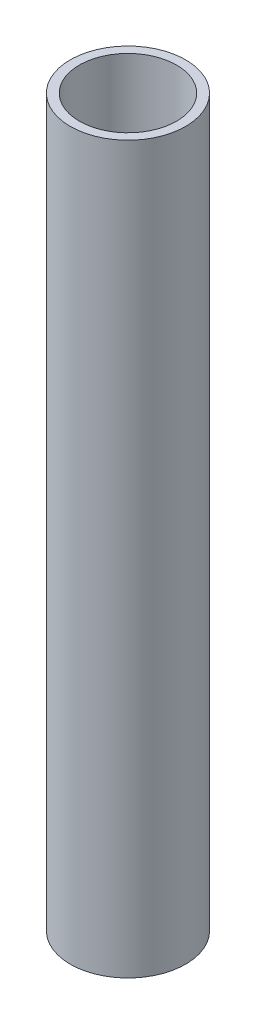
from build123d import *

# Parameters (mm, degrees)
SKETCH1_R           = 15.905
SKETCH1_R_2         = 13.405
BOSS_EXTRUDE1_DEPTH = 200


with BuildPart() as part:
    # Sketch1 → Boss-Extrude1 (new body)
    with BuildSketch(Plane(origin=(0, 0, 0), x_dir=(1, 0, 0), z_dir=(0, 1, 0))):
        with Locations(Location((0, 0, 0), (0, 0, 270))):
            Circle(SKETCH1_R)
        with Locations(Location((0, 0, 0), (0, 0, 270))):
            Circle(SKETCH1_R_2, mode=Mode.SUBTRACT)
    extrude(amount=-BOSS_EXTRUDE1_DEPTH)


solid = part.part
